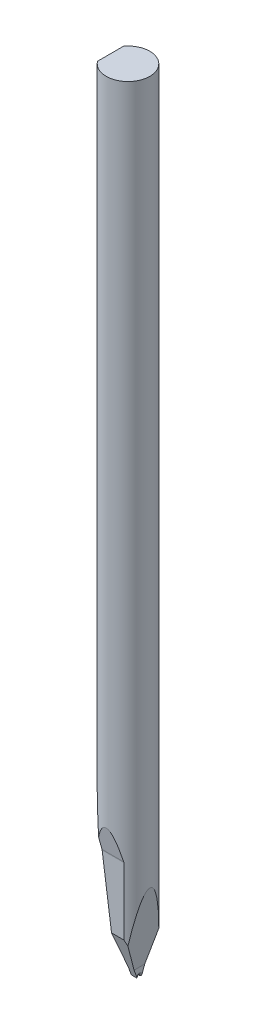
from build123d import *

# Parameters (mm, degrees)
SKETCH_TL_CUTTING_R    = 1.99771
TL_CUTTING_DEPTH       = 72.009
SKETCH_TDF_CUTTING_W   = 4.01541996
SKETCH_TDF_CUTTING_H   = 4.01541996
TDF_CUTTING_DEPTH      = 73.064400167
VW_VR_GRINDING_DEPTH   = 2.00770998
VW_VR_GRINDING_2_DEPTH = 2.00770998
ISA_GRINDING_DEPTH     = 2.00770998
SKETCH_PRE_FRX_BRX_W   = 0.93996002
SKETCH_PRE_FRX_BRX_H   = 0.78994
SKETCH_PRE_FRX_BRX_W_2 = 2.52443996
PRE_FRX_BRX_DEPTH      = 2.00770998
FA_BA_GRINDING_DEPTH   = 2.00770998
BR_EDM_R               = 0.09906
FR_EDM_R               = 0.20066


with BuildPart() as part:
    # sketch_TL_cutting → TL_cutting (new body)
    with BuildSketch(Plane(origin=(0, 0, 0), x_dir=(1, 0, 0), z_dir=(0, 1, 0))):
        with Locations(Location((0, 0, 0), (0, 0, 270))):
            Circle(SKETCH_TL_CUTTING_R)
    extrude(amount=TL_CUTTING_DEPTH)

    # sketch_TDF_cutting → TDF_cutting (cut, through all)
    with BuildSketch(Plane(origin=(0, 0, 0), x_dir=(1, 0, 0), z_dir=(0, 1, 0))):
        with Locations((-3.60917998, 0)):
            Rectangle(SKETCH_TDF_CUTTING_W, SKETCH_TDF_CUTTING_H)
    extrude(amount=TDF_CUTTING_DEPTH, mode=Mode.SUBTRACT)


with BuildPart() as body_2:
    # sketch_VW_VR_grinding → VW_VR_grinding (new, symmetric)
    with BuildSketch(Plane(origin=(0, 0, 0), x_dir=(0, 0, -1), z_dir=(1, 0, 0))):
        with BuildLine():
            Line((-1.59004, -0.00999998), (-1.59004, 9.977757879))
            ThreePointArc((-1.59004, 9.977757879), (-1.591006547, 9.999895438), (-1.593898831, 10.021864517))
            Line((-1.593898831, 10.021864517), (-2.01770996, 12.425416869))
            Line((-2.01770996, 12.425416869), (-2.00770998, -0.00999998))
            Line((-2.00770998, -0.00999998), (-1.59004, -0.00999998))
        make_face()
    extrude(amount=VW_VR_GRINDING_DEPTH, both=True)


with BuildPart() as body_3:
    # sketch_VW_VR_grinding → VW_VR_grinding 2 (new, symmetric)
    with BuildSketch(Plane(origin=(0, 0, 0), x_dir=(0, 0, -1), z_dir=(1, 0, 0))):
        with BuildLine():
            Line((1.59004, -0.00999998), (1.59004, 9.977757879))
            ThreePointArc((1.59004, 9.977757879), (1.591006547, 9.999895438), (1.593898831, 10.021864517))
            Line((1.593898831, 10.021864517), (2.01770996, 12.425416869))
            Line((2.01770996, 12.425416869), (2.00770998, -0.00999998))
            Line((2.00770998, -0.00999998), (1.59004, -0.00999998))
        make_face()
    extrude(amount=VW_VR_GRINDING_2_DEPTH, both=True)


    add(body_2.part)  # ISA_grinding merges body 2
    # sketch_ISA_grinding → ISA_grinding (add, symmetric)
    with BuildSketch(Plane(origin=(0, 0, 0), x_dir=(0, 0, -1), z_dir=(1, 0, 0))):
        Polygon((-0.19939, 0), (0.19939, 0), (2.00770998, 4.968318312), (2.00770998, -0.02999994), (-2.00770998, -0.02999994), (-2.00770998, 4.968318312), align=None)
    extrude(amount=ISA_GRINDING_DEPTH, both=True)

    # sketch_pre_FRX_BRX → pre_FRX_BRX (add, symmetric)
    with BuildSketch(Plane.XY):
        with Locations((1.52772999, 0.38497002)):
            Rectangle(SKETCH_PRE_FRX_BRX_W, SKETCH_PRE_FRX_BRX_H)
        with Locations((-0.75548998, 0.38497002)):
            Rectangle(SKETCH_PRE_FRX_BRX_W_2, SKETCH_PRE_FRX_BRX_H)
    extrude(amount=PRE_FRX_BRX_DEPTH, both=True)

    # sketch_FA_BA_grinding → FA_BA_grinding (add, symmetric)
    with BuildSketch(Plane.XY):
        Polygon((1.04775, -0.00999998), (1.04775, 0.78994), (2.12471, 8.452908576), (2.12471, -0.00999998), align=None)
        Polygon((0.50673, -0.00999998), (0.50673, 0.78994), (-1.72847, 16.694214403), (-1.72847, -0.00999998), align=None)
    extrude(amount=FA_BA_GRINDING_DEPTH, both=True)


with BuildPart() as part_1:
    add(part.part)

    # B1_fix: cut body 3
    add(body_3.part, mode=Mode.SUBTRACT)

    # V-Groove_EDM: sweep along a path in sketch_contour_V-Groove
    with BuildLine(Plane.XY) as v_groove_edm_path:
        Line((-1.60147, 0.14224), (1.99771, 0.14224))
    # sketch_section_V-Groove → V-Groove_EDM (sweep, cut)
    with BuildSketch(Plane(origin=(-1.60147, 0, -1.2954), x_dir=(0, 0, -1), z_dir=(1, 0, 0))):
        with BuildLine():
            Line((-1.262109661, 0.124910146), (-1.167644573, -0.00999998))
            Line((-1.167644573, -0.00999998), (-1.423155427, -0.00999998))
            Line((-1.423155427, -0.00999998), (-1.328690339, 0.124910146))
            ThreePointArc((-1.328690339, 0.124910146), (-1.2954, 0.14224), (-1.262109661, 0.124910146))
        make_face()
    sweep(path=v_groove_edm_path.line, mode=Mode.SUBTRACT)

    # BR_EDM
    br_edm_edges = [part_1.edges().sort_by_distance(p)[0] for p in [
        (0.50673, 0.14224, 0),
        (0.50673, 0.062455073, -0.077021852),
        (0.50673, 0.062455073, 0.077021852),
    ]]
    fillet(br_edm_edges, radius=BR_EDM_R)

    # FR_EDM
    fr_edm_edges = [part_1.edges().sort_by_distance(p)[0] for p in [
        (1.04775, 0.062455073, -0.077021852),
        (1.04775, 0.062455073, 0.077021852),
        (1.04775, 0.14224, 0),
    ]]
    fillet(fr_edm_edges, radius=FR_EDM_R)


solid = part_1.part
